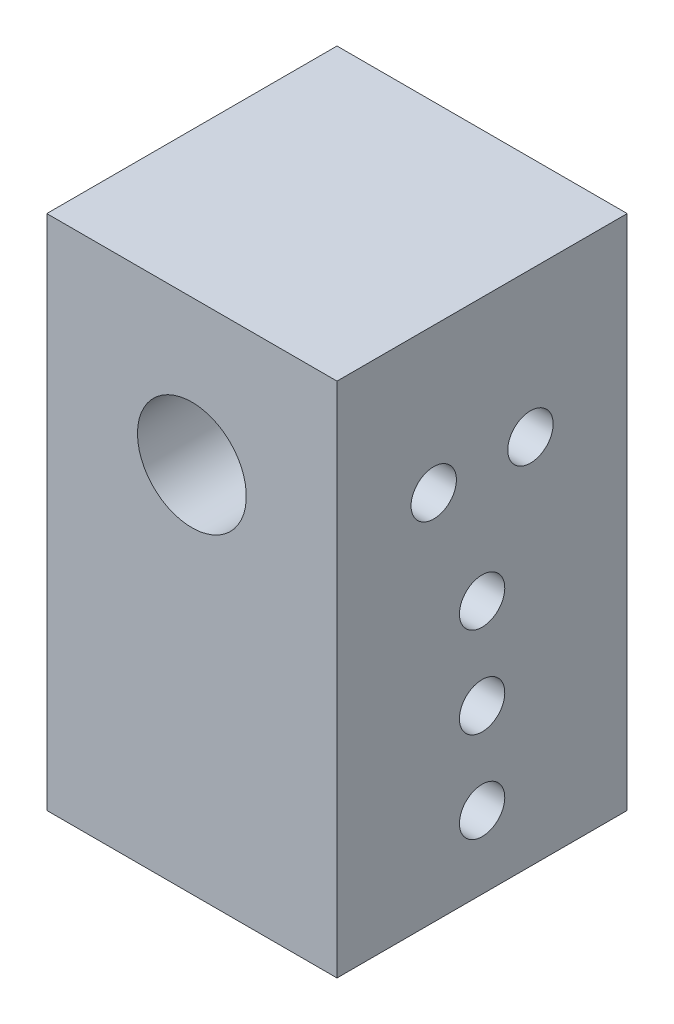
from build123d import *

# Parameters (mm, degrees)
SKETCH1_W           = 16
SKETCH1_H           = 28.5
BOSS_EXTRUDE1_DEPTH = 16
SKETCH2_R           = 5
CUT_EXTRUDE1_DEPTH  = 16
SKETCH3_R           = 3
CUT_EXTRUDE2_DEPTH  = 34.648922717
SKETCH4_R           = 1.25
CUT_EXTRUDE3_DEPTH  = 10
SKETCH6_R           = 1.25
CUT_EXTRUDE4_DEPTH  = 8


with BuildPart() as part:
    # Sketch1 → Boss-Extrude1 (new body)
    with BuildSketch(Plane.XY):
        with Locations((0, 14.25)):
            Rectangle(SKETCH1_W, SKETCH1_H)
    extrude(amount=BOSS_EXTRUDE1_DEPTH)

    # Sketch2 → Cut-Extrude1 (cut)
    with BuildSketch(Plane(origin=(0, 0, 0), x_dir=(-1, 0, 0), z_dir=(0, -1, 0))):
        with Locations(Location((0, -8, 0), (0, 0, 90))):
            Circle(SKETCH2_R)
    extrude(amount=-CUT_EXTRUDE1_DEPTH, mode=Mode.SUBTRACT)

    # Sketch3 → Cut-Extrude2 (cut, through all)
    with BuildSketch(Plane(origin=(0, 0, 0), x_dir=(-1, 0, 0), z_dir=(0, 0, -1))):
        with Locations((0, 20.5)):
            Circle(SKETCH3_R)
    extrude(amount=-CUT_EXTRUDE2_DEPTH, mode=Mode.SUBTRACT)

    # Sketch4 → Cut-Extrude3 (cut)
    with BuildSketch(Plane(origin=(8, 0, 0), x_dir=(0, 0, -1), z_dir=(1, 0, 0))):
        with Locations(Location((-10.666666667, 20.5, 0), (0, 0, 90))):
            Circle(SKETCH4_R)
        with Locations(Location((-5.333333333, 20.5, 0), (0, 0, 90))):
            Circle(SKETCH4_R)
    extrude(amount=-CUT_EXTRUDE3_DEPTH, mode=Mode.SUBTRACT)

    # Sketch6 → Cut-Extrude4 (cut)
    with BuildSketch(Plane(origin=(8, 0, 0), x_dir=(0, 0, -1), z_dir=(1, 0, 0))):
        with Locations(Location((-8, 14, 0), (0, 0, 90))):
            Circle(SKETCH6_R)
        with Locations(Location((-8, 9, 0), (0, 0, 90))):
            Circle(SKETCH6_R)
        with Locations(Location((-8, 4, 0), (0, 0, 90))):
            Circle(SKETCH6_R)
    extrude(amount=-CUT_EXTRUDE4_DEPTH, mode=Mode.SUBTRACT)


solid = part.part
